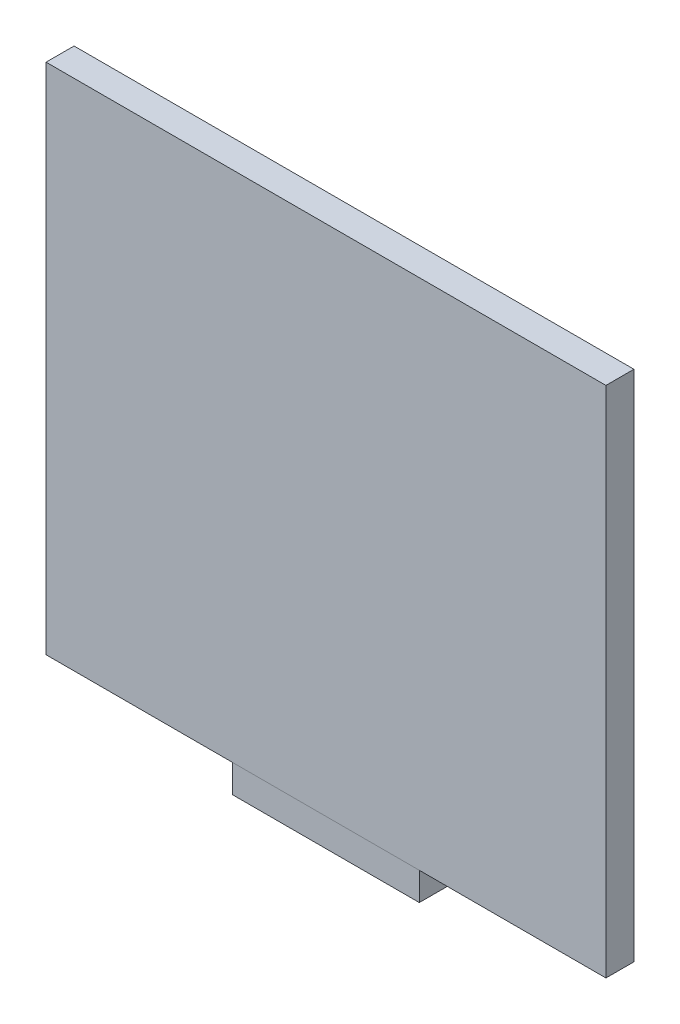
from build123d import *

# Parameters (mm, degrees)
SKETCH2_W           = 60
SKETCH2_H           = 55
BOSS_EXTRUDE1_DEPTH = 3
SKETCH3_W           = 20
SKETCH3_H           = 3
BOSS_EXTRUDE2_DEPTH = 3


with BuildPart() as part:
    # Sketch2 → Boss-Extrude1 (new body)
    with BuildSketch(Plane.XY):
        with Locations((30, 27.5)):
            Rectangle(SKETCH2_W, SKETCH2_H)
    extrude(amount=-BOSS_EXTRUDE1_DEPTH)


with BuildPart() as body_2:
    # Sketch3 → Boss-Extrude2 (new body)
    with BuildSketch(Plane.XY):
        with Locations((30, -1.5)):
            Rectangle(SKETCH3_W, SKETCH3_H)
    extrude(amount=-BOSS_EXTRUDE2_DEPTH)


solid = Compound([part.part, body_2.part])
